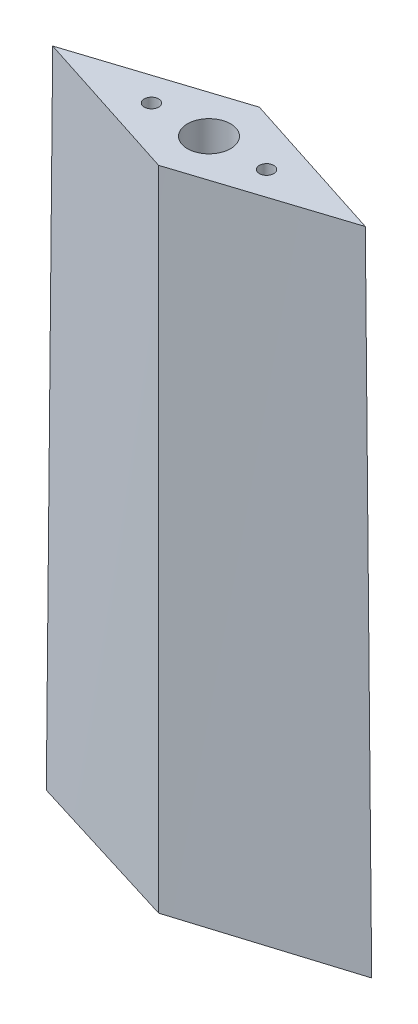
from build123d import *

# Parameters (mm, degrees)
BOSS_EXTRUDE1_DEPTH      = 11.1125
BOSS_EXTRUDE1_DEPTH_BACK = 11.1125
SKETCH5_W                = 109.877468776
SKETCH5_H                = 283.051122129
CUT_EXTRUDE2_DEPTH       = 1193.492852366
SKETCH6_W                = 149.121482991
SKETCH6_H                = 108.921761737
CUT_EXTRUDE3_DEPTH       = 1175.662940665
SKETCH7_R                = 4.7625
CUT_EXTRUDE4_DEPTH       = 635
CUT_EXTRUDE8_DEPTH       = 1195.766301895
CUT_EXTRUDE8_DEPTH_BACK  = 1195.766301895
SKETCH8_W                = 149.774750394
SKETCH8_H                = 148.832770831
SKETCH8_H_2              = 142.875
SKETCH8_H_3              = 176.125878949
SKETCH13_R               = 1.5875
CUT_EXTRUDE11_DEPTH      = 12.7
CUT_EXTRUDE12_START      = -12.7
SKETCH14_R               = 1.5875
CUT_EXTRUDE12_DEPTH      = 12.7


with BuildPart() as part:
    # Sketch1 → Boss-Extrude1 (new, two sides: drawn at the far end of the back side and taken through both)
    with BuildSketch(Plane.XY.offset(-BOSS_EXTRUDE1_DEPTH_BACK)):
        Polygon((142.42123069, 465.168027231), (219.716026672, 465.168027231), (213.502471629, 1096.967634552), (181.068628681, 1174.337215652), (148.634785732, 1096.967634552), align=None)
    extrude(amount=BOSS_EXTRUDE1_DEPTH + BOSS_EXTRUDE1_DEPTH_BACK)

    # Sketch2 → Cut-Loft1 section 0
    with BuildSketch(Plane.XZ.offset(-465.168027231)):
        with BuildLine():
            Line((142.42123069, 0), (181.068628681, 11.1125))
            Line((181.068628681, 11.1125), (219.716026672, 0))
            Line((219.716026672, 0), (222.70513775, 0))
            Line((222.70513775, 0), (222.70513775, 15.258366339))
            Line((222.70513775, 15.258366339), (137.848628215, 15.258366339))
            Line((137.848628215, 15.258366339), (137.848628215, 0))
            Line((137.848628215, 0), (142.42123069, 0))
        make_face()
    # Sketch3 → Cut-Loft1 section 1
    with BuildSketch(Plane(origin=(0, 1096.967634552, 0), x_dir=(1, 0, 0), z_dir=(0, 1, 0))):
        with BuildLine():
            Line((213.502471629, 0), (181.068628681, -11.1125))
            Line((181.068628681, -11.1125), (148.634785732, 0))
            Line((148.634785732, 0), (137.848628215, 0))
            Line((137.848628215, 0), (137.848628215, -15.258366339))
            Line((137.848628215, -15.258366339), (222.70513775, -15.258366339))
            Line((222.70513775, -15.258366339), (222.70513775, 0))
            Line((222.70513775, 0), (213.502471629, 0))
        make_face()
    cut_loft1 = loft(mode=Mode.SUBTRACT)

    # Mirror1: Cut-Loft1 across plane
    add(cut_loft1.mirror(Plane.XY), mode=Mode.SUBTRACT)

    # Sketch5 → Cut-Extrude2 (cut, through all)
    with BuildSketch(Plane(origin=(-32.103098407, 13.457832356, 93.698704331), x_dir=(0.9470206004067627, 0.045661094409327196, 0.31791043842968925), z_dir=(-0.3211728232668741, 0.1346377834927197, 0.937401026696127))):
        with Locations((219.349244299, 1139.303724701)):
            Rectangle(SKETCH5_W, SKETCH5_H)
    cut_extrude2 = extrude(amount=CUT_EXTRUDE2_DEPTH, mode=Mode.SUBTRACT)

    # Sketch6 → Cut-Extrude3 (cut, through all)
    with BuildSketch(Plane(origin=(69.458274406, 29.117370568, 202.726547902), x_dir=(0.9470206004067623, -0.045661094409327495, -0.31791043842969063), z_dir=(0.3211728232668754, 0.13463778349272, 0.9374010266961263))):
        with Locations((131.752816965, 1118.922251835)):
            Rectangle(SKETCH6_W, SKETCH6_H)
    cut_extrude3 = extrude(amount=CUT_EXTRUDE3_DEPTH, mode=Mode.SUBTRACT)

    # Mirror2: Cut-Extrude2, Cut-Extrude3 across plane
    add(cut_extrude2.mirror(Plane.XY), mode=Mode.SUBTRACT)
    add(cut_extrude3.mirror(Plane.XY), mode=Mode.SUBTRACT)

    # Sketch7 → Cut-Extrude4 (cut)
    with BuildSketch(Plane.XZ.offset(-465.168027231)):
        with Locations(Location((181.068628681, 0, 0), (0, 0, 270))):
            Circle(SKETCH7_R)
    extrude(amount=-CUT_EXTRUDE4_DEPTH, mode=Mode.SUBTRACT)

    # Sketch8 → Cut-Extrude8 (cut, two sides: drawn at the far end of the back side and taken through both)
    with BuildSketch(Plane.XY.offset(-CUT_EXTRUDE8_DEPTH_BACK)):
        with Locations((180.5976389, 528.420830237)):
            Rectangle(SKETCH8_W, SKETCH8_H)
        with Locations((180.5976389, 960.024715652)):
            Rectangle(SKETCH8_W, SKETCH8_H_2)
        with Locations((180.5976389, 1119.525155127)):
            Rectangle(SKETCH8_W, SKETCH8_H_3)
        with Locations((180.5976389, 674.274715652)):
            Rectangle(SKETCH8_W, SKETCH8_H_2)
    extrude(amount=CUT_EXTRUDE8_DEPTH + CUT_EXTRUDE8_DEPTH_BACK, mode=Mode.SUBTRACT)

    # Sketch13 → Cut-Extrude11 (cut)
    with BuildSketch(Plane.XZ.offset(-745.712215652)):
        with Locations(Location((168.368628681, 0, 0), (0, 0, 270))):
            Circle(SKETCH13_R)
        with Locations(Location((193.768628681, 0, 0), (0, 0, 270))):
            Circle(SKETCH13_R)
    extrude(amount=-CUT_EXTRUDE11_DEPTH, mode=Mode.SUBTRACT)

    # Sketch14 → Cut-Extrude12 (cut)
    with BuildSketch(Plane(origin=(0, 888.587215652, 0), x_dir=(1, 0, 0), z_dir=(0, 1, 0)).offset(CUT_EXTRUDE12_START)):
        with Locations(Location((168.368628681, 0, 0), (0, 0, 90))):
            Circle(SKETCH14_R)
        with Locations(Location((193.768628681, 0, 0), (0, 0, 90))):
            Circle(SKETCH14_R)
    extrude(amount=CUT_EXTRUDE12_DEPTH, mode=Mode.SUBTRACT)


solid = part.part
